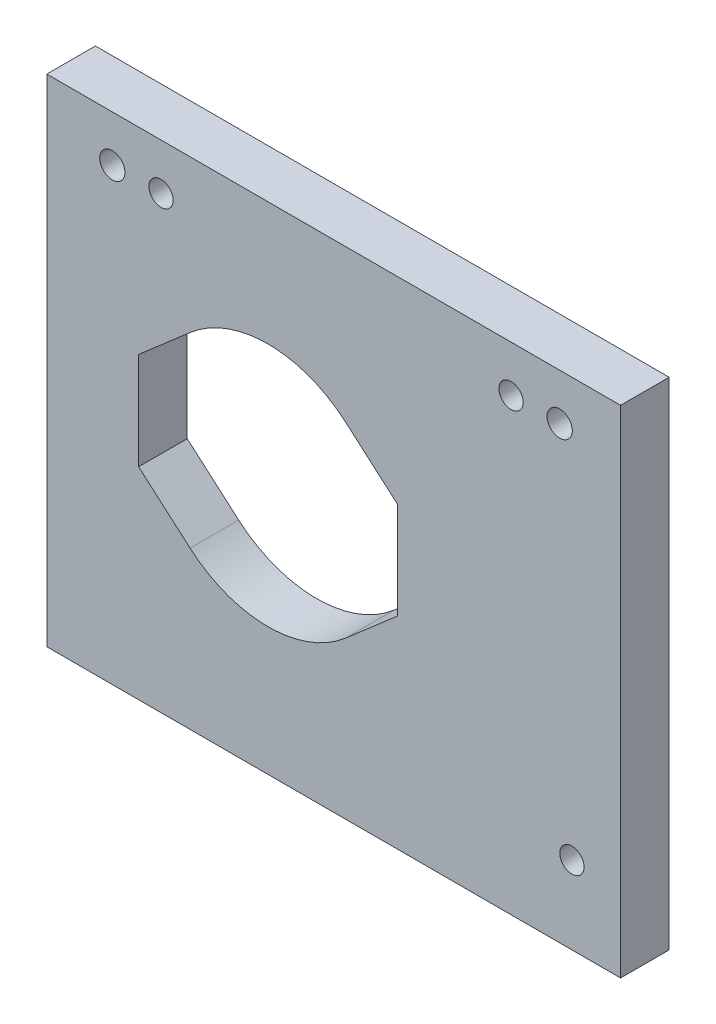
from build123d import *

# Parameters (mm, degrees)
CROQUIS1_W              = 59
CROQUIS1_H              = 51
CROQUIS1_R              = 1.25
CROQUIS1_R_2            = 1.3
SALIENTE_EXTRUIR1_DEPTH = 5


with BuildPart() as part:
    # Croquis1 → Saliente-Extruir1 (new body)
    with BuildSketch(Plane.XY):
        with Locations((-0.238863052, -0.247607665)):
            Rectangle(CROQUIS1_W, CROQUIS1_H)
        with Locations((24.261136948, -17.747607665)):
            Circle(CROQUIS1_R, mode=Mode.SUBTRACT)
        with Locations((-18, 20.5)):
            Circle(CROQUIS1_R, mode=Mode.SUBTRACT)
        with Locations((18, 20.5)):
            Circle(CROQUIS1_R, mode=Mode.SUBTRACT)
        with Locations((-23, 20.5)):
            Circle(CROQUIS1_R_2, mode=Mode.SUBTRACT)
        with Locations((23, 20.5)):
            Circle(CROQUIS1_R_2, mode=Mode.SUBTRACT)
        with BuildLine():
            Line((-20.3, 5), (-20.3, -5))
            Line((-20.3, -5), (-15.007684576, -9.598280457))
            ThreePointArc((-15.007684576, -9.598280457), (-7, -12.591121267), (1.007684576, -9.598280457))
            Line((1.007684576, -9.598280457), (6.3, -5))
            Line((6.3, -5), (6.3, 5))
            Line((6.3, 5), (1.007684576, 9.598280457))
            ThreePointArc((1.007684576, 9.598280457), (-7, 12.591121267), (-15.007684576, 9.598280457))
            Line((-15.007684576, 9.598280457), (-20.3, 5))
        make_face(mode=Mode.SUBTRACT)
    extrude(amount=SALIENTE_EXTRUIR1_DEPTH)


solid = part.part
